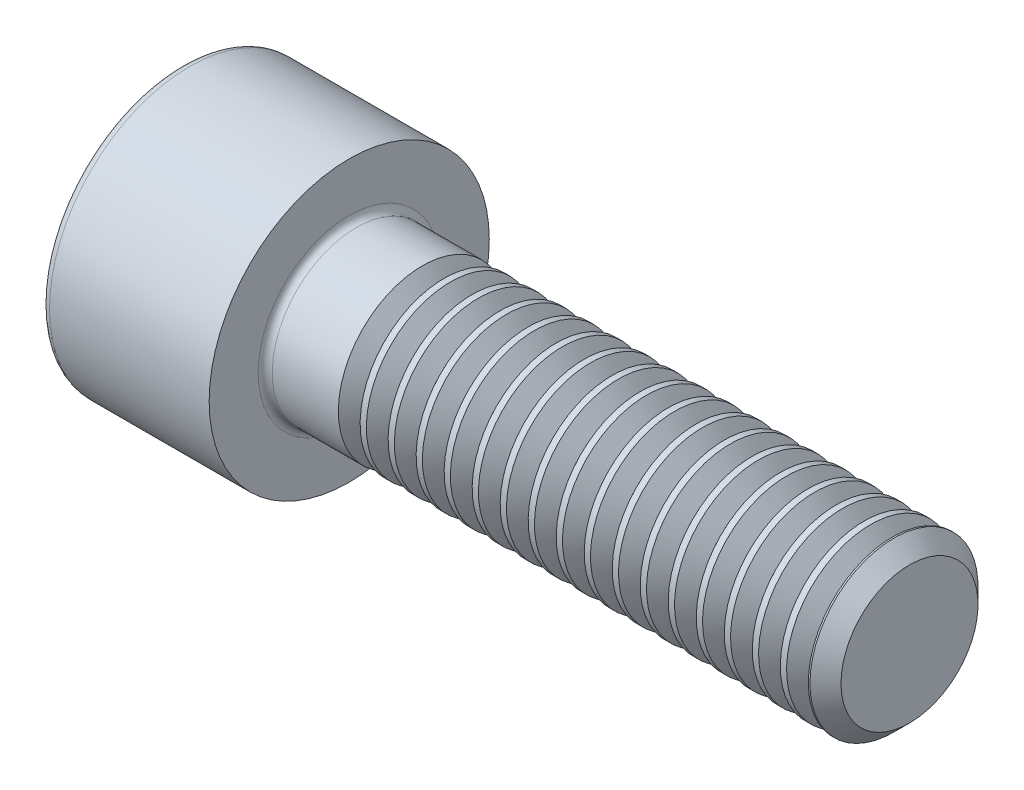
from build123d import *

# Parameters (mm, degrees)
FILLET1_R       = 0.25
FILLET2_R       = 0.3
HEX_2_DEPTH     = 3
THDSCHPAT_COUNT = 17
THDSCHPAT_PITCH = 1


with BuildPart() as part:
    # BodySke → Base-Revolve (revolve)
    with BuildSketch(Plane.XY, mode=Mode.PRIVATE) as base_revolve_sk:
        Polygon((0, 0), (0, 5), (6, 5), (6, 3), (25.4455, 3), (26, 2.4455), (26, 0), align=None)
    revolve(base_revolve_sk.sketch.rotate(Axis((-31.75, 0, 0), (1, 0, 0)), 90), axis=Axis((-31.75, 0, 0), (1, 0, 0)))

    # Fillet1
    fillet1_edges = [part.edges().sort_by_distance(p)[0] for p in [
        (6, 0, -3),
    ]]
    fillet(fillet1_edges, radius=FILLET1_R)

    # Fillet2
    fillet2_edges = [part.edges().sort_by_distance(p)[0] for p in [
        (0, 0, -5),
    ]]
    fillet(fillet2_edges, radius=FILLET2_R)

    # Sketch2 → Hex-PreBroach (revolve, cut)
    with BuildSketch(Plane.XY, mode=Mode.PRIVATE) as hex_prebroach_sk:
        Polygon((0, 2.542), (3, 2.542), (4.467624384, 0), (0, 0), align=None)
    revolve(hex_prebroach_sk.sketch.rotate(Axis((0, 0, 0), (1, 0, 0)), 90), axis=Axis((0, 0, 0), (1, 0, 0)), mode=Mode.SUBTRACT)

    # Sketch3 → Hex 2 (cut)
    with BuildSketch(Plane(origin=(0, 0, 0), x_dir=(0, 0.500000000000001, 0.866025403784438), z_dir=(-1, 0, 0))):
        Polygon((1.467624384, 2.542), (-1.467624384, 2.542), (-2.935248769, 0), (-1.467624384, -2.542), (1.467624384, -2.542), (2.935248769, 0), align=None)
    extrude(amount=-HEX_2_DEPTH, mode=Mode.SUBTRACT)

    # ThdSchSke → ThreadSchematic (revolve, cut)
    with BuildSketch(Plane.XY):
        Polygon((9, -2.4455), (8.61173492, -3), (8.61173492, -3.75), (9.38826508, -3.75), (9.38826508, -3), align=None)
    threadschematic = revolve(axis=Axis((-3.175, 0, 0), (1, 0, 0)), mode=Mode.SUBTRACT)

    # ThdSchPat: ThreadSchematic ×17
    with Locations(*[(i * THDSCHPAT_PITCH, 0, 0) for i in range(1, THDSCHPAT_COUNT)]):
        add(threadschematic, mode=Mode.SUBTRACT)


solid = part.part
